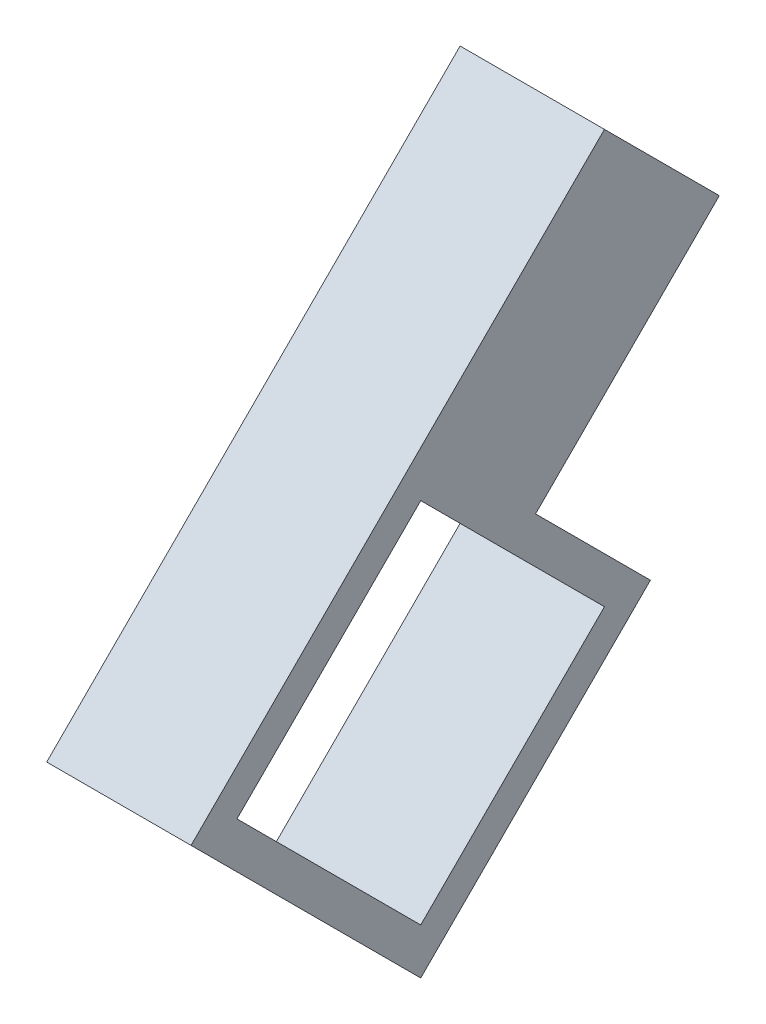
from build123d import *

# Parameters (mm, degrees)
EXTRUDE_1_DEPTH     = 20
CUT_EXTRUDE_1_DEPTH = 20


with BuildPart() as part:
    # 草图2 → 凸台-拉伸1 (new body)
    with BuildSketch(Plane(origin=(0, 0, 0), x_dir=(0, 0, -1), z_dir=(1, 0, 0))):
        Polygon((0, -31.819805153), (31.819805153, 0), (15.909902577, 15.909902577), (41.365746699, 41.365746699), (25.455844123, 57.275649276), (-15.909902577, 15.909902577), (-31.819805153, 0), align=None)
    extrude(amount=EXTRUDE_1_DEPTH)

    # 草图3 → 切除-拉伸1 (cut)
    with BuildSketch(Plane(origin=(20, 0, 0), x_dir=(0, 0, -1), z_dir=(1, 0, 0))):
        Polygon((0, -25.455844123), (25.455844123, 0), (0, 25.455844123), (-25.455844123, 0), align=None)
    extrude(amount=-CUT_EXTRUDE_1_DEPTH, mode=Mode.SUBTRACT)


solid = part.part
